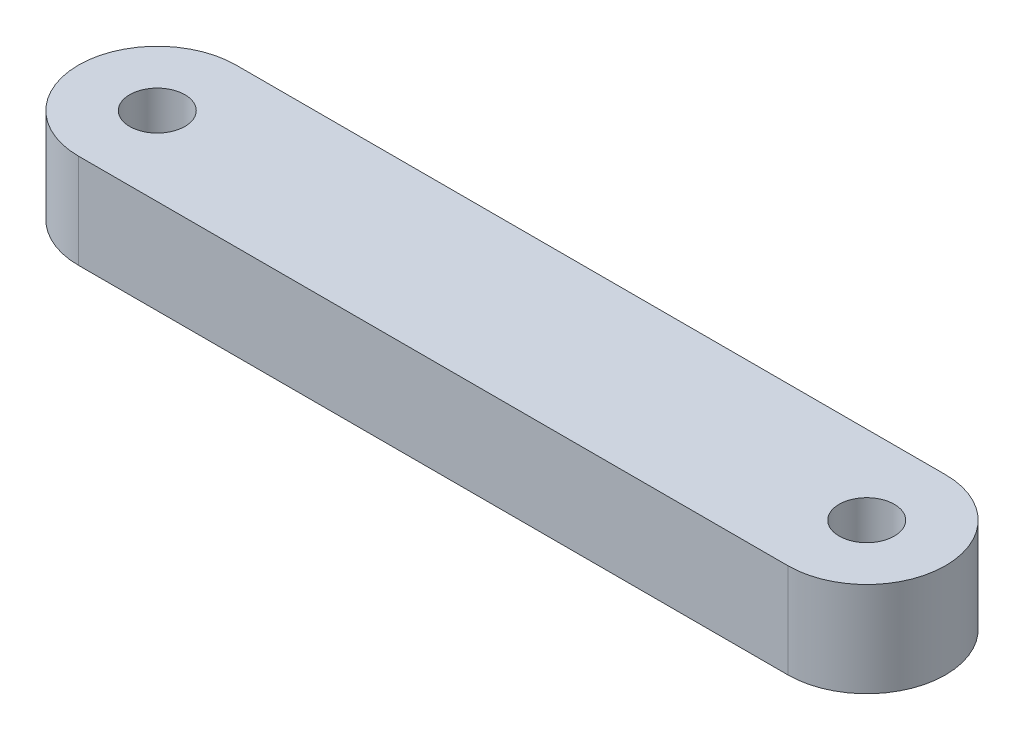
from build123d import *

# Parameters (mm, degrees)
SKETCH1_R           = 1.75
BOSS_EXTRUDE1_DEPTH = 6


with BuildPart() as part:
    # Sketch1 → Boss-Extrude1 (new body)
    with BuildSketch(Plane(origin=(0, 0, 0), x_dir=(1, 0, 0), z_dir=(0, 1, 0))):
        with BuildLine():
            Line((-22.5, 5), (22.5, 5))
            ThreePointArc((22.5, 5), (27.5, 0), (22.5, -5))
            Line((22.5, -5), (-22.5, -5))
            ThreePointArc((-22.5, -5), (-27.5, 0), (-22.5, 5))
        make_face()
        with Locations(Location((-22.5, 0, 0), (0, 0, 270))):
            Circle(SKETCH1_R, mode=Mode.SUBTRACT)
        with Locations(Location((22.5, 0, 0), (0, 0, 270))):
            Circle(SKETCH1_R, mode=Mode.SUBTRACT)
    extrude(amount=BOSS_EXTRUDE1_DEPTH)


solid = part.part
